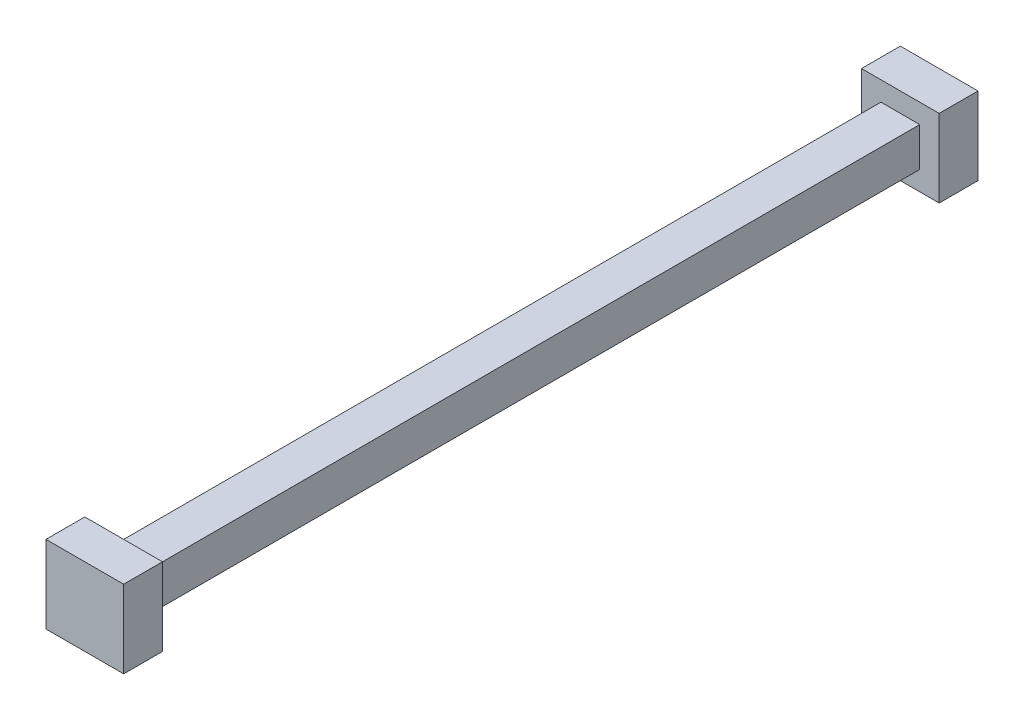
from build123d import *

# Parameters (mm, degrees)
SKETCH_1_W      = 10
SKETCH_1_H      = 10
EXTRUDE_1_DEPTH = 200
SKETCH_2_W      = 20
SKETCH_2_H      = 20
EXTRUDE_2_DEPTH = 10
SKETCH_3_W      = 20
SKETCH_3_H      = 20
EXTRUDE_3_DEPTH = 10


with BuildPart() as part:
    # 草图1 → 凸台-拉伸1 (new body)
    with BuildSketch(Plane.XY):
        Rectangle(SKETCH_1_W, SKETCH_1_H)
    extrude(amount=EXTRUDE_1_DEPTH)

    # 草图2 → 凸台-拉伸2 (add)
    with BuildSketch(Plane.XY.offset(200)):
        Rectangle(SKETCH_2_W, SKETCH_2_H)
    extrude(amount=EXTRUDE_2_DEPTH)

    # 草图3 → 凸台-拉伸3 (add)
    with BuildSketch(Plane(origin=(0, 0, 0), x_dir=(-1, 0, 0), z_dir=(0, 0, -1))):
        Rectangle(SKETCH_3_W, SKETCH_3_H)
    extrude(amount=EXTRUDE_3_DEPTH)


solid = part.part
